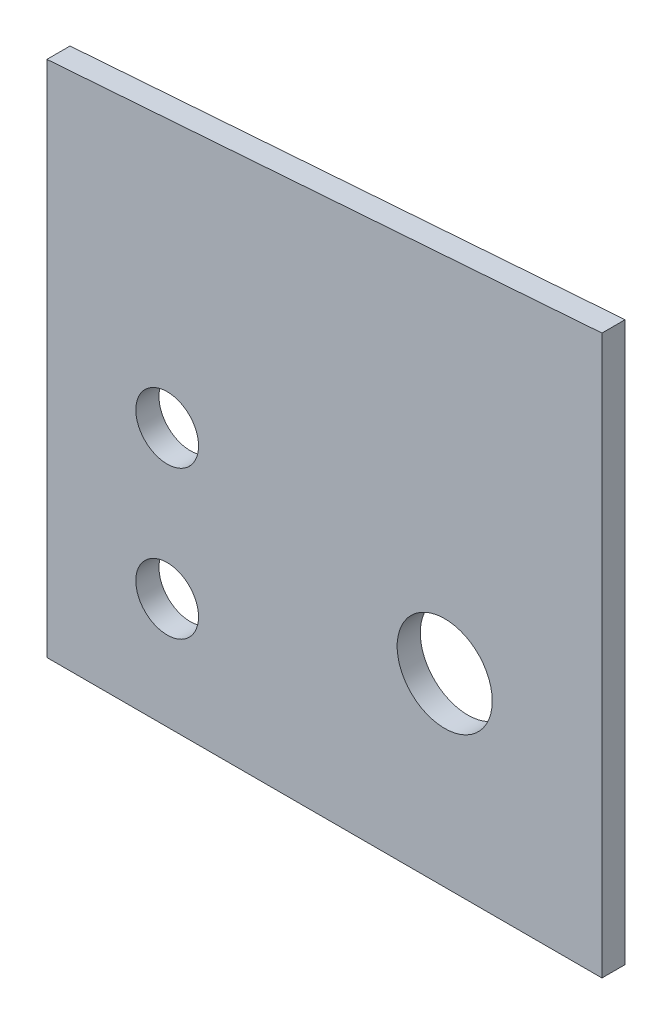
from build123d import *

# Parameters (mm, degrees)
SKETCH1_W           = 16.51
SKETCH1_H           = 25.4
SKETCH1_R           = 2.15265
SKETCH1_W_2         = 21.59
SKETCH1_R_2         = 3.2639
BOSS_EXTRUDE1_DEPTH = 1.5875


with BuildPart() as part:
    # Sketch1 → Boss-Extrude1 (new body)
    # profile 1 of 4: a face of its own
    with BuildSketch(Plane.XY):
        Polygon((0, 35.56), (0, 25.4), (16.51, 25.4), (38.1, 25.4), (38.1, 35.56), align=None)
    # profile 2 of 4: a face of its own
    with BuildSketch(Plane.XY):
        with Locations((8.255, 12.7)):
            Rectangle(SKETCH1_W, SKETCH1_H)
        with Locations((8.255, 7.62)):
            Circle(SKETCH1_R, mode=Mode.SUBTRACT)
        with Locations((8.255, 17.78)):
            Circle(SKETCH1_R, mode=Mode.SUBTRACT)
    # profile 3 of 4: a face of its own
    with BuildSketch(Plane.XY):
        with Locations((27.305, 12.7)):
            Rectangle(SKETCH1_W_2, SKETCH1_H)
        with Locations((27.305, 12.7)):
            Circle(SKETCH1_R_2, mode=Mode.SUBTRACT)
    # profile 4 of 4: a face of its own
    with BuildSketch(Plane.XY):
        Polygon((38.1, 38.34043763), (38.1, 35.56), (0, 35.56), align=None)
    extrude(amount=BOSS_EXTRUDE1_DEPTH)


solid = part.part
